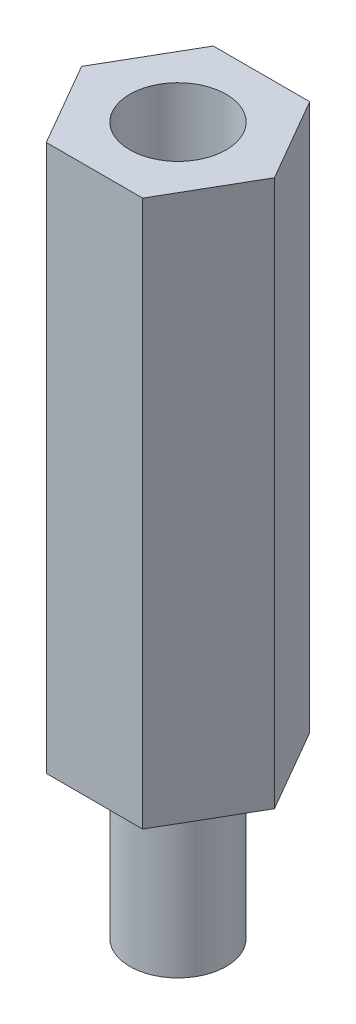
from build123d import *

# Parameters (mm, degrees)
SKETCH1_R           = 1.5
BOSS_EXTRUDE1_DEPTH = 15
BOSS_EXTRUDE2_DEPTH = 2
BOSS_EXTRUDE3_START = 5
SKETCH3_R           = 1.5
BOSS_EXTRUDE3_DEPTH = 5


with BuildPart() as part:
    # Sketch1 → Boss-Extrude1 (new body)
    with BuildSketch(Plane(origin=(0, 0, 0), x_dir=(1, 0, 0), z_dir=(0, 1, 0))):
        Polygon((3, 0), (1.5, 2.598076211), (-1.5, 2.598076211), (-3, 0), (-1.5, -2.598076211), (1.5, -2.598076211), align=None)
        with Locations(Location((0, 0, 0), (0, 0, 270))):
            Circle(SKETCH1_R, mode=Mode.SUBTRACT)
    extrude(amount=BOSS_EXTRUDE1_DEPTH)

    # Sketch2 → Boss-Extrude2 (add)
    with BuildSketch(Plane.XZ):
        Polygon((1.5, 2.598076211), (-1.5, 2.598076211), (-3, 0), (-1.5, -2.598076211), (1.5, -2.598076211), (3, 0), align=None)
    extrude(amount=BOSS_EXTRUDE2_DEPTH)

    # Sketch3 → Boss-Extrude3 (add)
    with BuildSketch(Plane.XZ.offset(2).offset(BOSS_EXTRUDE3_START)):
        with Locations(Location((0, 0, 0), (0, 0, 90))):
            Circle(SKETCH3_R)
    extrude(amount=-BOSS_EXTRUDE3_DEPTH)


solid = part.part
